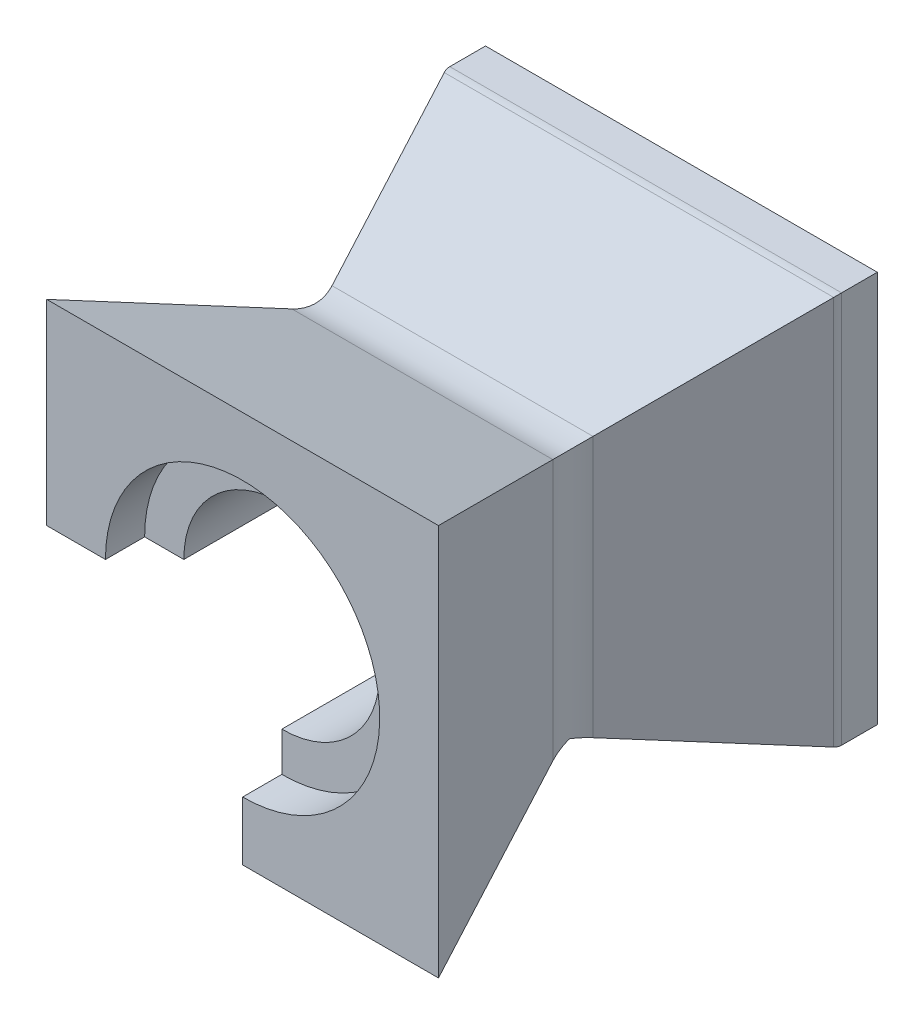
from build123d import *

# Parameters (mm, degrees)
ESQUISSE2_W                  = 100
ESQUISSE2_H                  = 100
BOSS_EXTRU_1_DEPTH           = 51
BOSS_EXTRU_1_TAPER           = 20
ENL_V_MAT_EXTRU_1_DEPTH      = 140.622233322
ENL_V_MAT_EXTRU_1_DEPTH_BACK = 140.622233322
ESQUISSE3_R                  = 25
ENL_V_MAT_EXTRU_2_DEPTH      = 140.622233322
ENL_V_MAT_EXTRU_2_DEPTH_BACK = 10
ESQUISSE5_R                  = 35
ENL_V_START                  = -10
ESQUISSE6_R                  = 35
ENL_V_MAT_EXTRU_3_DEPTH      = 10
ESQUISSE7_W                  = 50
ESQUISSE7_H                  = 50
ENL_V_MAT_EXTRU_4_DEPTH      = 140.622233322
CONG_1_R                     = 15
ENL_V_MAT_EXTRU_8_DEPTH      = 10
BOSS_EXTRU_2_DEPTH           = 10
CONG_2_R                     = 5


with BuildPart() as part:
    # Esquisse2 → Boss.-Extru.1 (new body)
    with BuildSketch(Plane.XY):
        with Locations((-23.410404624, -10.838150289)):
            Rectangle(ESQUISSE2_W, ESQUISSE2_H)
    boss_extru_1 = extrude(amount=BOSS_EXTRU_1_DEPTH, taper=BOSS_EXTRU_1_TAPER)

    # Symétrie4: Boss.-Extru.1 across plane
    add(boss_extru_1.mirror(Plane.XY.offset(51)))

    # Esquisse3 → Enlèv. mat.-Extru.1 (cut, two sides: drawn at the far end of the back side and taken through both)
    with BuildSketch(Plane.XY.offset(102).offset(-ENL_V_MAT_EXTRU_1_DEPTH_BACK)):
        with Locations((-23.410404624, -10.838150289)):
            Circle(ESQUISSE3_R)
    extrude(amount=ENL_V_MAT_EXTRU_1_DEPTH + ENL_V_MAT_EXTRU_1_DEPTH_BACK, mode=Mode.SUBTRACT)

    # Esquisse5 → Enlèv. mat.-Extru.2 (cut, two sides: drawn at the far end of the back side and taken through both)
    with BuildSketch(Plane.XY.offset(102).offset(-ENL_V_MAT_EXTRU_2_DEPTH_BACK)):
        with Locations(Location((-23.410404624, -10.838150289, 0), (0, 0, 180))):
            Circle(ESQUISSE5_R)
    extrude(amount=ENL_V_MAT_EXTRU_2_DEPTH + ENL_V_MAT_EXTRU_2_DEPTH_BACK, mode=Mode.SUBTRACT)

    # Esquisse6 → Enlèv. mat.-Extru.3 (cut)
    with BuildSketch(Plane(origin=(0, 0, 0), x_dir=(-1, 0, 0), z_dir=(0, 0, -1)).offset(ENL_V_START)):
        with Locations((23.410404624, -10.838150289)):
            Circle(ESQUISSE6_R)
    extrude(amount=ENL_V_MAT_EXTRU_3_DEPTH, mode=Mode.SUBTRACT)

    # Esquisse7 → Enlèv. mat.-Extru.4 (cut, through all)
    with BuildSketch(Plane(origin=(0, 0, 0), x_dir=(-1, 0, 0), z_dir=(0, 0, -1))):
        with Locations((48.410404624, -35.838150289)):
            Rectangle(ESQUISSE7_W, ESQUISSE7_H)
    extrude(amount=-ENL_V_MAT_EXTRU_4_DEPTH, mode=Mode.SUBTRACT)

    # Congé1
    cong_1_edges = [part.edges().sort_by_distance(p)[0] for p in [
        (8.027113428, -10.838150289, 51),
        (-23.410404624, 20.599367763, 51),
        (-54.847922677, 4.880608737, 51),
    ]]
    fillet(cong_1_edges, radius=CONG_1_R)

    # Esquisse8 → Enlèv. mat.-Extru.8 (cut)
    with BuildSketch(Plane(origin=(0, 0, 0), x_dir=(-1, 0, 0), z_dir=(0, 0, -1))):
        with BuildLine():
            Line((-15.12691495, 31.941809973), (-4.520313233, 21.335208255))
            ThreePointArc((-4.520313233, 21.335208255), (-4.520313233, 17.092567568), (-8.76295392, 17.092567568))
            Line((-8.76295392, 17.092567568), (-19.369555638, 27.699169286))
            ThreePointArc((-19.369555638, 27.699169286), (-19.369555638, 31.941809973), (-15.12691495, 31.941809973))
        make_face()
        with BuildLine():
            Line((-19.369555638, -49.375469864), (-8.76295392, -38.768868146))
            ThreePointArc((-8.76295392, -38.768868146), (-4.520313233, -38.768868146), (-4.520313233, -43.011508833))
            Line((-4.520313233, -43.011508833), (-15.12691495, -53.618110551))
            ThreePointArc((-15.12691495, -53.618110551), (-19.369555638, -53.618110551), (-19.369555638, -49.375469864))
        make_face()
        with BuildLine():
            Line((51.341122481, 21.335208255), (61.947724199, 31.941809973))
            ThreePointArc((61.947724199, 31.941809973), (66.190364886, 31.941809973), (66.190364886, 27.699169286))
            Line((66.190364886, 27.699169286), (55.583763168, 17.092567568))
            ThreePointArc((55.583763168, 17.092567568), (51.341122481, 17.092567568), (51.341122481, 21.335208255))
        make_face()
    extrude(amount=-ENL_V_MAT_EXTRU_8_DEPTH, mode=Mode.SUBTRACT)

    # Esquisse9 → Boss.-Extru.2 (add)
    with BuildSketch(Plane(origin=(0, 0, 0), x_dir=(-1, 0, 0), z_dir=(0, 0, -1))):
        Polygon((-26.589595376, -60.838150289), (23.410404624, -60.838150289), (23.410404624, -57.838150289), (-23.589595376, -57.838150289), (-23.589595376, 36.161849711), (70.410404624, 36.161849711), (70.410404624, -10.838150289), (73.410404624, -10.838150289), (73.410404624, 39.161849711), (-26.589595376, 39.161849711), align=None)
    extrude(amount=BOSS_EXTRU_2_DEPTH)

    # Congé2
    cong_2_edges = [part.edges().sort_by_distance(p)[0] for p in [
        (-23.410404624, 39.161849711, 0),
        (26.589595376, -10.838150289, 0),
        (-73.410404624, 14.161849711, 0),
        (1.589595376, -60.838150289, 0),
    ]]
    fillet(cong_2_edges, radius=CONG_2_R)


solid = part.part
